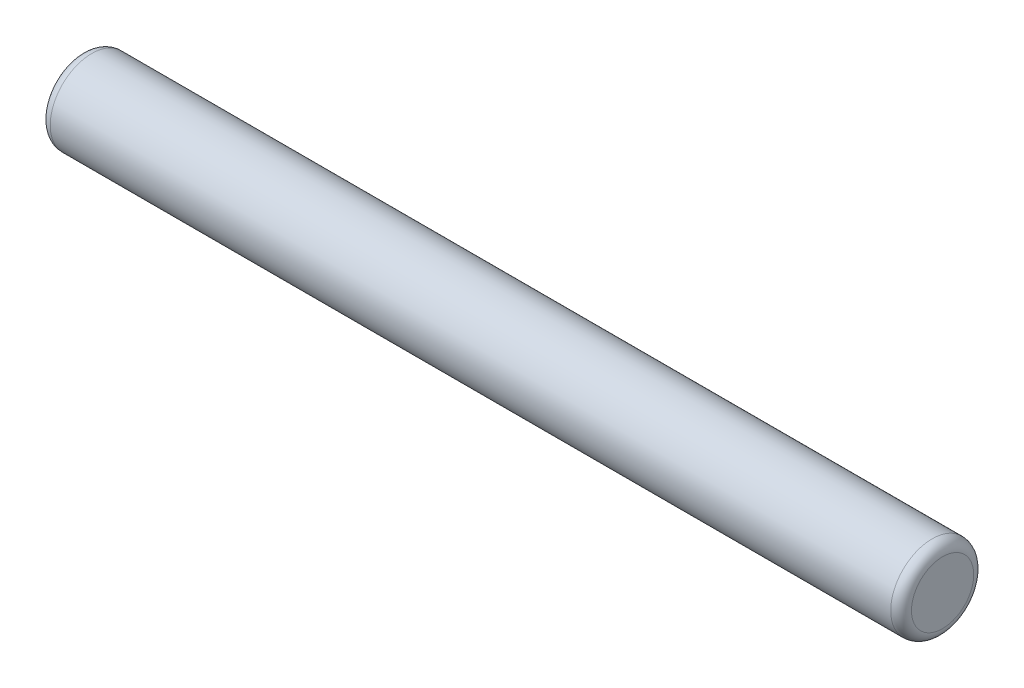
from build123d import *

# Parameters (mm, degrees)
SKETCH1_R           = 4
BOSS_EXTRUDE1_DEPTH = 83
FILLET1_R           = 1


with BuildPart() as part:
    # Sketch1 → Boss-Extrude1 (new body)
    with BuildSketch(Plane(origin=(0, 0, 0), x_dir=(0, 0, -1), z_dir=(1, 0, 0))):
        Circle(SKETCH1_R)
    extrude(amount=BOSS_EXTRUDE1_DEPTH)

    # Fillet1
    fillet1_edges = [part.edges().sort_by_distance(p)[0] for p in [
        (0, 0, 4),
        (83, 0, 4),
    ]]
    fillet(fillet1_edges, radius=FILLET1_R)


solid = part.part
